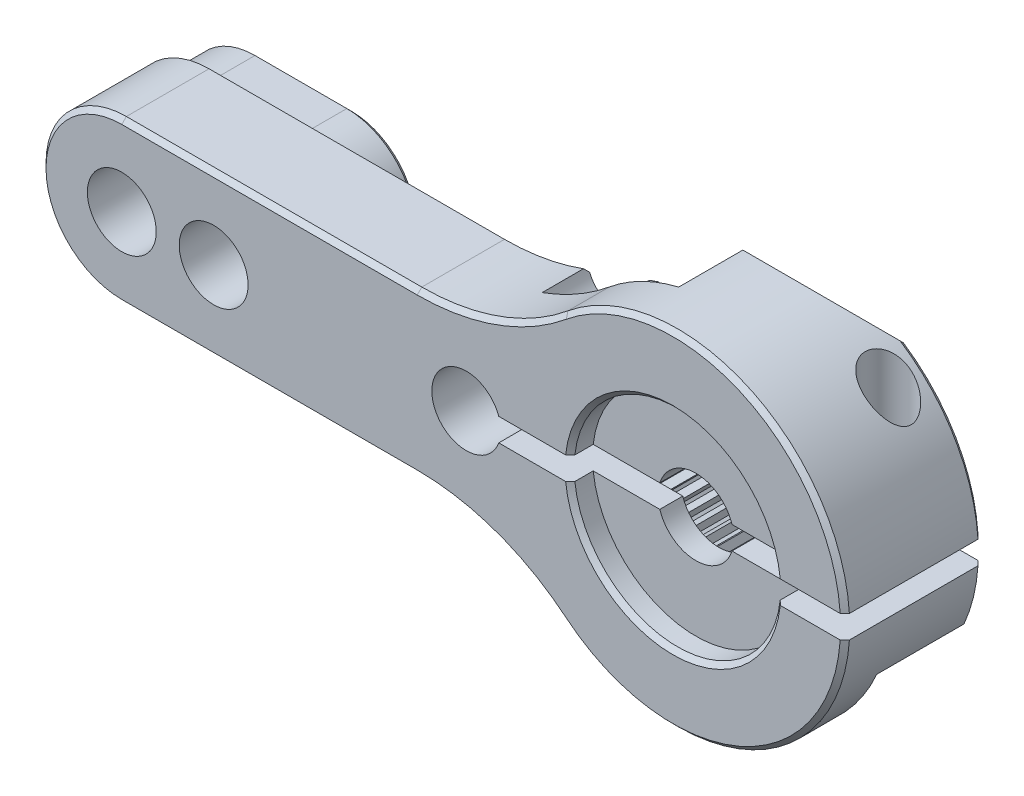
from build123d import *

# Parameters (mm, degrees)
ESQUISSE1_R                  = 1.65
ESQUISSE1_R_2                = 1.5
BOSS_EXTRU_1_DEPTH           = 6
ESQUISSE2_W                  = 18.914213562
ESQUISSE2_H                  = 1
ENL_V_MAT_EXTRU_1_DEPTH      = 6
ENL_V_MAT_EXTRU_2_DEPTH      = 2
ENL_V_MAT_EXTRU_3_DEPTH      = 4
ESQUISSE5_R                  = 1
ENL_V_MAT_EXTRU_4_DEPTH      = 31.041637772
ESQUISSE6_R                  = 1
ENL_V_MAT_EXTRU_5_DEPTH      = 31.041637792
ENL_V_MAT_EXTRU_6_DEPTH      = 10
ENL_V_MAT_EXTRU_6_DEPTH_BACK = 10
ESQUISSE8_R                  = 3
ENL_V_MAT_EXTRU_7_DEPTH      = 4
BOSS_EXTRU_2_DEPTH           = 4
R_P_TITION_CIRCULAIRE1_COUNT = 36
ESQUISSE10_W                 = 11.375009128
ESQUISSE10_H                 = 1
ENL_V_MAT_EXTRU_8_DEPTH      = 30.129023374
CHANFREIN1_SIZE              = 0.2
ESQUISSE11_R                 = 4.5
ENL_V_MAT_EXTRU_9_DEPTH      = 1
CHANFREIN2_SIZE              = 0.2


with BuildPart() as part:
    # Esquisse1 → Boss.-Extru.1 (new body)
    with BuildSketch(Plane.XY):
        with BuildLine():
            Line((-11.135528726, 3.5), (-24, 3.5))
            ThreePointArc((-24, 3.5), (-27.5, 0), (-24, -3.5))
            Line((-24, -3.5), (-11.135528726, -3.5))
            ThreePointArc((-11.135528726, -3.5), (-7.754911707, -4.088760519), (-4.772369454, -5.785714286))
            ThreePointArc((-4.772369454, -5.785714286), (7.5, 0), (-4.772369454, 5.785714286))
            ThreePointArc((-4.772369454, 5.785714286), (-7.754911707, 4.088760519), (-11.135528726, 3.5))
        make_face()
        Circle(ESQUISSE1_R, mode=Mode.SUBTRACT)
        with Locations((-9, 0)):
            Circle(ESQUISSE1_R_2, mode=Mode.SUBTRACT)
        with Locations((-24, 0)):
            Circle(ESQUISSE1_R_2, mode=Mode.SUBTRACT)
        with Locations((-20, 0)):
            Circle(ESQUISSE1_R_2, mode=Mode.SUBTRACT)
    extrude(amount=BOSS_EXTRU_1_DEPTH)

    # Esquisse2 → Enlèv. mat.-Extru.1 (cut)
    with BuildSketch(Plane.XY.offset(6)):
        with Locations((-0.957106781, 0)):
            Rectangle(ESQUISSE2_W, ESQUISSE2_H)
    extrude(amount=-ENL_V_MAT_EXTRU_1_DEPTH, mode=Mode.SUBTRACT)

    # Esquisse3 → Enlèv. mat.-Extru.2 (cut)
    with BuildSketch(Plane(origin=(0, 0, 0), x_dir=(-1, 0, 0), z_dir=(0, 0, -1))):
        with BuildLine():
            Line((24, -3.5), (11.135528726, -3.5))
            ThreePointArc((11.135528726, -3.5), (7.754911707, -4.088760519), (4.772369454, -5.785714286))
            ThreePointArc((4.772369454, -5.785714286), (7.5, 0), (4.772369454, 5.785714286))
            ThreePointArc((4.772369454, 5.785714286), (7.754911707, 4.088760519), (11.135528726, 3.5))
            Line((11.135528726, 3.5), (24, 3.5))
            ThreePointArc((24, 3.5), (27.5, 0), (24, -3.5))
        make_face()
        with BuildLine():
            Line((24, -3), (20, -3))
            ThreePointArc((20, -3), (17, 0), (20, 3))
            Line((20, 3), (24, 3))
            ThreePointArc((24, 3), (27, 0), (24, -3))
        make_face(mode=Mode.SUBTRACT)
    extrude(amount=-ENL_V_MAT_EXTRU_2_DEPTH, mode=Mode.SUBTRACT)

    # Esquisse4 → Enlèv. mat.-Extru.3 (cut)
    with BuildSketch(Plane(origin=(0, 0, 0), x_dir=(-1, 0, 0), z_dir=(0, 0, -1))):
        with BuildLine():
            Line((-7.5, -3), (-3.25, -3))
            ThreePointArc((-3.25, -3), (-2.189339828, -3.439339828), (-1.75, -4.5))
            Line((-1.75, -4.5), (-1.75, -7.5))
            Line((-1.75, -7.5), (-7.5, -7.5))
            Line((-7.5, -7.5), (-7.5, -3))
        make_face()
        with BuildLine():
            Line((1.75, 7.5), (7.75, 7.5))
            Line((7.75, 7.5), (7.75, 4.5))
            ThreePointArc((7.75, 4.5), (7.310660172, 3.439339828), (6.25, 3))
            Line((6.25, 3), (3.25, 3))
            ThreePointArc((3.25, 3), (2.189339828, 3.439339828), (1.75, 4.5))
            Line((1.75, 4.5), (1.75, 7.5))
        make_face()
    extrude(amount=-ENL_V_MAT_EXTRU_3_DEPTH, mode=Mode.SUBTRACT)

    # Esquisse5 → Enlèv. mat.-Extru.4 (cut, through all)
    with BuildSketch(Plane.XZ.offset(3)):
        with Locations((4.873863542, 1.5)):
            Circle(ESQUISSE5_R)
    extrude(amount=-ENL_V_MAT_EXTRU_4_DEPTH, mode=Mode.SUBTRACT)

    # Esquisse6 → Enlèv. mat.-Extru.5 (cut, through all)
    with BuildSketch(Plane(origin=(0, 3, 0), x_dir=(1, 0, 0), z_dir=(0, 1, 0))):
        with Locations(Location((-5.233314774, -1.5, 0), (0, 0, 270))):
            Circle(ESQUISSE6_R)
    extrude(amount=-ENL_V_MAT_EXTRU_5_DEPTH, mode=Mode.SUBTRACT)

    # Esquisse7 → Enlèv. mat.-Extru.6 (cut, two sides: drawn at the far end of the back side and taken through both)
    with BuildSketch(Plane(origin=(0, 0, 0), x_dir=(0, 0, -1), z_dir=(1, 0, 0)).offset(-ENL_V_MAT_EXTRU_6_DEPTH_BACK)):
        Polygon((-1.414213562, 7.5), (0, 6.085786438), (0, 7.5), align=None)
        Polygon((0, -6.085786438), (-1.414213562, -7.5), (0, -7.5), align=None)
    extrude(amount=ENL_V_MAT_EXTRU_6_DEPTH + ENL_V_MAT_EXTRU_6_DEPTH_BACK, mode=Mode.SUBTRACT)

    # Esquisse8 → Enlèv. mat.-Extru.7 (cut)
    with BuildSketch(Plane(origin=(0, 0, 0), x_dir=(-1, 0, 0), z_dir=(0, 0, -1))):
        Circle(ESQUISSE8_R)
    extrude(amount=-ENL_V_MAT_EXTRU_7_DEPTH, mode=Mode.SUBTRACT)

    # Esquisse9 → Boss.-Extru.2 (add)
    with BuildSketch(Plane(origin=(0, 0, 0), x_dir=(-1, 0, 0), z_dir=(0, 0, -1))):
        Polygon((-0.202072594, 3), (0, 2.65), (0.202072594, 3), align=None)
    boss_extru_2 = extrude(amount=-BOSS_EXTRU_2_DEPTH)

    # Répétition circulaire1: Boss.-Extru.2 ×36 about axis, 2 skipped
    r_p_tition_circulaire1_axis = Axis((0, 0, 0), (0, 0, -1))
    add([boss_extru_2.rotate(r_p_tition_circulaire1_axis, i * 360 / R_P_TITION_CIRCULAIRE1_COUNT) for i in range(1, R_P_TITION_CIRCULAIRE1_COUNT) if i not in (9, 27)])

    # Esquisse10 → Enlèv. mat.-Extru.8 (cut, through all)
    with BuildSketch(Plane(origin=(0, 0, 0), x_dir=(-1, 0, 0), z_dir=(0, 0, -1))):
        with Locations((-1.79581021, 0)):
            Rectangle(ESQUISSE10_W, ESQUISSE10_H)
    extrude(amount=-ENL_V_MAT_EXTRU_8_DEPTH, mode=Mode.SUBTRACT)

    # Chanfrein1
    chanfrein1_edges = [part.edges().sort_by_distance(p)[0] for p in [
        (-22, 3, 0),
        (-7.271599305, 1.836802534, 0),
        (7.28660705, -1.776332655, 0),
        (-7.754911707, -4.088760519, 6),
        (2.970185181, -6.886798965, 6),
        (-8.527137949, -3.84617705, 2),
        (-7.754911707, 4.088760519, 6),
        (-17.567764363, 3.5, 6),
        (6.557767222, 3.639462744, 0),
        (2.970185181, 6.886798965, 6),
        (-27.5, 0, 6),
        (-6.557767222, -3.639462744, 0),
        (-17.567764363, -3.5, 6),
        (-9.39008473, 3.653506956, 2),
        (-17.567764363, 3.5, 2),
        (-27.5, 0, 2),
        (-17.567764363, -3.5, 2),
        (-27, 0, 0),
        (-17, 0, 0),
    ]]
    chamfer(chanfrein1_edges, length=CHANFREIN1_SIZE)

    # Esquisse11 → Enlèv. mat.-Extru.9 (cut)
    with BuildSketch(Plane.XY.offset(6)):
        Circle(ESQUISSE11_R)
    extrude(amount=-ENL_V_MAT_EXTRU_9_DEPTH, mode=Mode.SUBTRACT)

    # Chanfrein2
    chanfrein2_edges = [part.edges().sort_by_distance(p)[0] for p in [
        (0, 4.5, 6),
        (0, -4.5, 6),
    ]]
    chamfer(chanfrein2_edges, length=CHANFREIN2_SIZE)


solid = part.part
